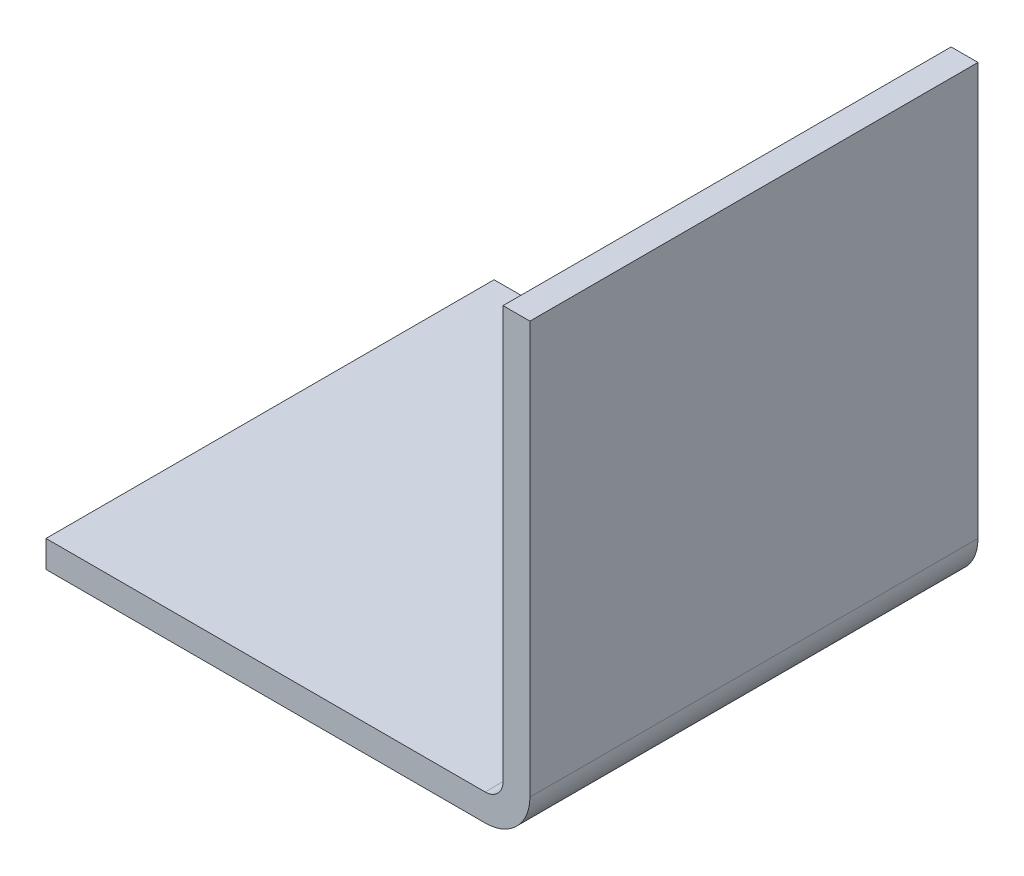
from build123d import *

# Parameters (mm, degrees)
EXTRUDE_THIN1_DEPTH = 50


with BuildPart() as part:
    # Sketch1 → Extrude-Thin1 (new body)
    with BuildSketch(Plane.XY):
        with BuildLine():
            Line((0, 51), (0, 5))
            ThreePointArc((0, 5), (-1.464466094, 1.464466094), (-5, 0))
            Line((-5, 0), (-54, 0))
            Line((-54, 0), (-54, 3))
            Line((-54, 3), (-5, 3))
            ThreePointArc((-5, 3), (-3.585786438, 3.585786438), (-3, 5))
            Line((-3, 5), (-3, 51))
            Line((-3, 51), (0, 51))
        make_face()
    extrude(amount=EXTRUDE_THIN1_DEPTH)


solid = part.part
